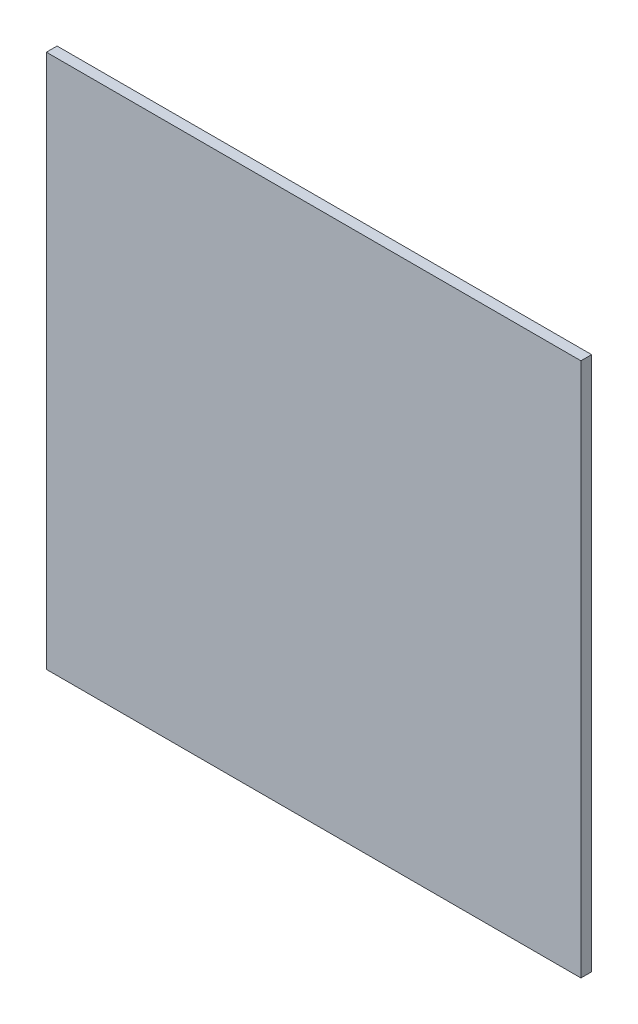
from build123d import *

# Parameters (mm, degrees)
CROQUIS1_W              = 150
CROQUIS1_H              = 150
SALIENTE_EXTRUIR1_DEPTH = 3


with BuildPart() as part:
    # Croquis1 → Saliente-Extruir1 (new body)
    with BuildSketch(Plane.XY):
        Rectangle(CROQUIS1_W, CROQUIS1_H)
    extrude(amount=SALIENTE_EXTRUIR1_DEPTH)


solid = part.part
